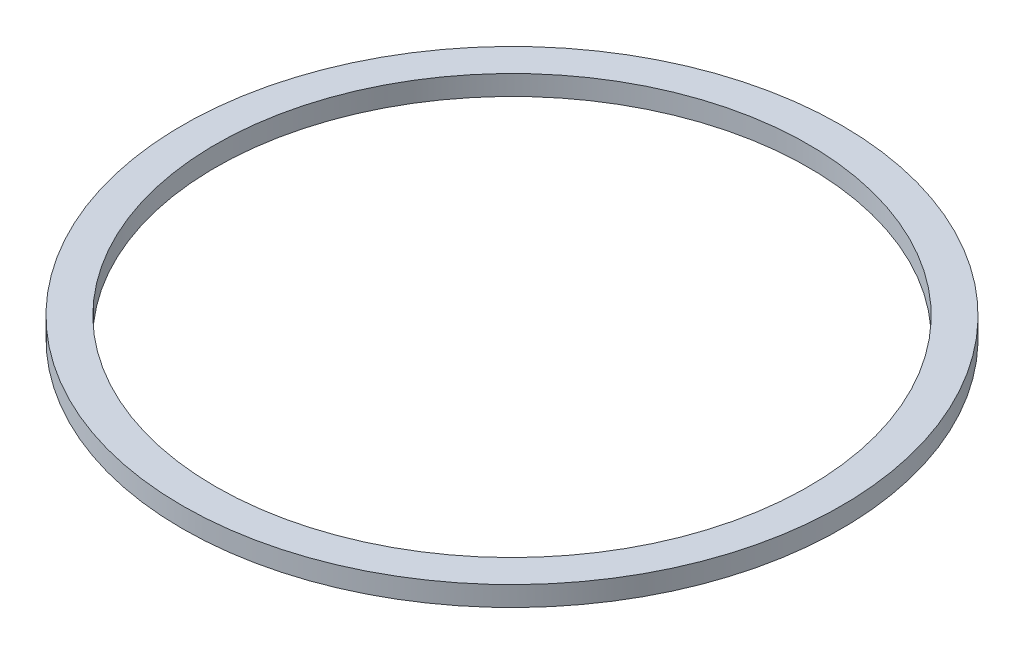
from build123d import *

# Parameters (mm, degrees)
SKETCH1_R           = 9945
SKETCH1_R_2         = 8945
BOSS_EXTRUDE1_DEPTH = 600


with BuildPart() as part:
    # Sketch1 → Boss-Extrude1 (new body)
    with BuildSketch(Plane(origin=(0, 0, 0), x_dir=(1, 0, 0), z_dir=(0, 1, 0))):
        with Locations(Location((0, 0, 0), (0, 0, 270))):
            Circle(SKETCH1_R)
        with Locations(Location((0, 0, 0), (0, 0, 270))):
            Circle(SKETCH1_R_2, mode=Mode.SUBTRACT)
    extrude(amount=BOSS_EXTRUDE1_DEPTH)


solid = part.part
